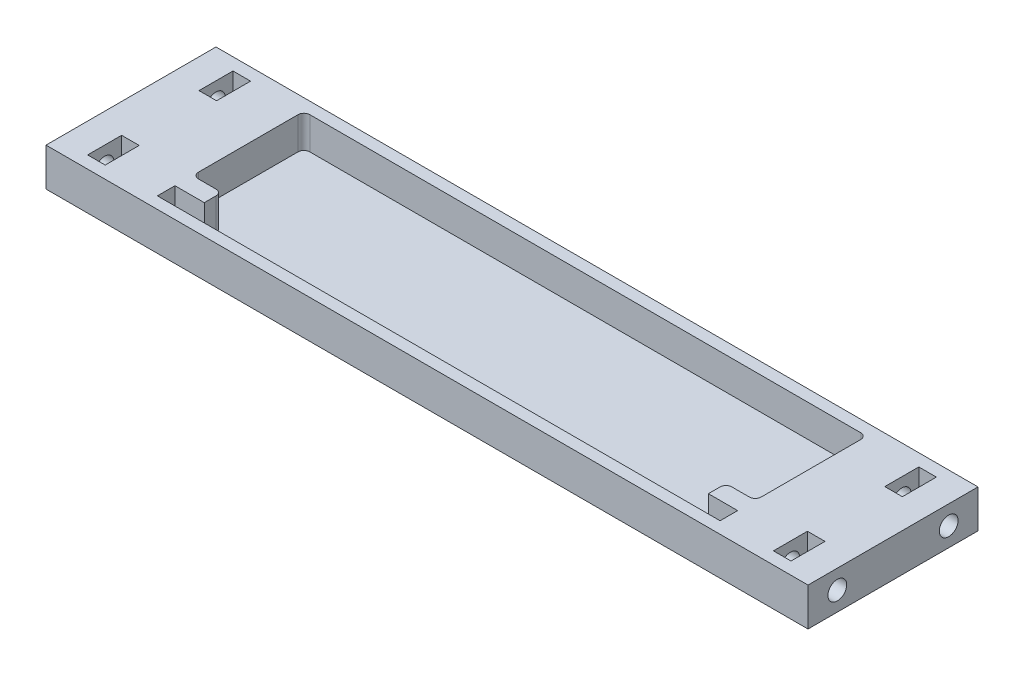
from build123d import *

# Parameters (mm, degrees)
CROQUIS1_W              = 130
CROQUIS1_H              = 29
SALIENTE_EXTRUIR1_DEPTH = 6.5
CORTAR_EXTRUIR1_DEPTH   = 5.5
CROQUIS3_W              = 3
CROQUIS3_H              = 5.8
CORTAR_EXTRUIR2_DEPTH   = 67.91412407
CROQUIS4_R              = 1.6
CORTAR_EXTRUIR3_DEPTH   = 15
CORTAR_EXTRUIR4_START   = -15
CROQUIS5_R              = 1.6
CORTAR_EXTRUIR4_DEPTH   = 15
REDONDEO1_R             = 1


with BuildPart() as part:
    # Croquis1 → Saliente-Extruir1 (new body)
    with BuildSketch(Plane(origin=(0, 0, 0), x_dir=(1, 0, 0), z_dir=(0, 1, 0))):
        Rectangle(CROQUIS1_W, CROQUIS1_H)
    extrude(amount=SALIENTE_EXTRUIR1_DEPTH)

    # Croquis2 → Cortar-Extruir1 (cut)
    with BuildSketch(Plane(origin=(0, 6.5, 0), x_dir=(1, 0, 0), z_dir=(0, 1, 0))):
        Polygon((48, 12.5), (-48, 12.5), (-48, -6.5), (-43, -6.5), (-43, -9.5), (-48, -9.5), (-48, -12.5), (48, -12.5), (48, -9.5), (43, -9.5), (43, -6.5), (48, -6.5), align=None)
    extrude(amount=-CORTAR_EXTRUIR1_DEPTH, mode=Mode.SUBTRACT)

    # Croquis3 → Cortar-Extruir2 (cut, through all)
    with BuildSketch(Plane(origin=(0, 6.5, 0), x_dir=(1, 0, 0), z_dir=(0, 1, 0))):
        with Locations((-58.5, -9.5)):
            Rectangle(CROQUIS3_W, CROQUIS3_H)
        with Locations((-58.5, 9.5)):
            Rectangle(CROQUIS3_W, CROQUIS3_H)
        with Locations((58.5, -9.5)):
            Rectangle(CROQUIS3_W, CROQUIS3_H)
        with Locations((58.5, 9.5)):
            Rectangle(CROQUIS3_W, CROQUIS3_H)
    extrude(amount=-CORTAR_EXTRUIR2_DEPTH, mode=Mode.SUBTRACT)

    # Croquis4 → Cortar-Extruir3 (cut)
    with BuildSketch(Plane.ZY.offset(65)):
        with Locations((-9.5, 3.25)):
            Circle(CROQUIS4_R)
        with Locations(Location((9.5, 3.25, 0), (0, 0, 180))):
            Circle(CROQUIS4_R)
    extrude(amount=-CORTAR_EXTRUIR3_DEPTH, mode=Mode.SUBTRACT)

    # Croquis5 → Cortar-Extruir4 (cut)
    with BuildSketch(Plane(origin=(65, 0, 0), x_dir=(0, 0, -1), z_dir=(1, 0, 0)).offset(CORTAR_EXTRUIR4_START)):
        with Locations((-9.5, 3.25)):
            Circle(CROQUIS5_R)
        with Locations(Location((9.5, 3.25, 0), (0, 0, 180))):
            Circle(CROQUIS5_R)
    extrude(amount=CORTAR_EXTRUIR4_DEPTH, mode=Mode.SUBTRACT)

    # Redondeo1
    redondeo1_edges = [part.edges().sort_by_distance(p)[0] for p in [
        (-48, 3.75, 6.5),
        (-48, 3.75, -12.5),
        (48, 3.75, -12.5),
        (48, 3.75, 6.5),
        (43, 3.75, 6.5),
        (-43, 3.75, 6.5),
    ]]
    fillet(redondeo1_edges, radius=REDONDEO1_R)


solid = part.part
